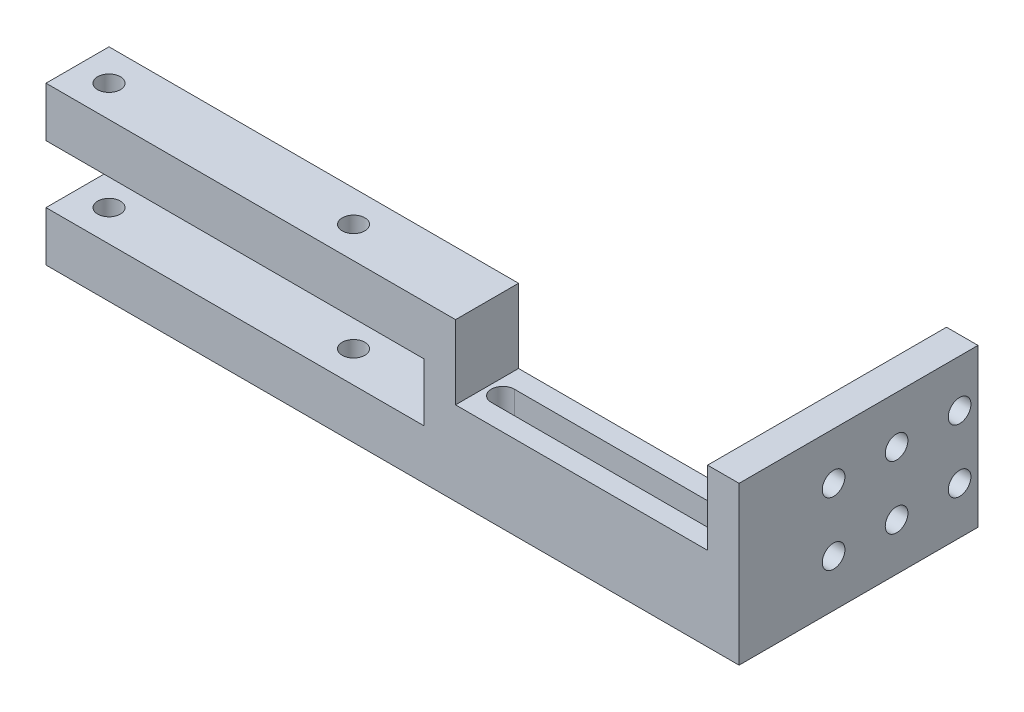
from build123d import *

# Parameters (mm, degrees)
SKETCH1_W           = 110
SKETCH1_H           = 10
SKETCH1_R           = 1.8
BOSS_EXTRUDE1_DEPTH = 25
SKETCH2_W           = 10
SKETCH2_H           = 9.2
CUT_EXTRUDE1_DEPTH  = 60
SKETCH16_W          = 5
SKETCH16_H          = 25
BOSS_EXTRUDE2_DEPTH = 10
SKETCH17_R          = 1.8
CUT_EXTRUDE6_DEPTH  = 10
SKETCH18_W          = 5
SKETCH18_H          = 25
BOSS_EXTRUDE3_DEPTH = 20
SKETCH19_R          = 1.8
CUT_EXTRUDE7_DEPTH  = 12
SKETCH20_W          = 5
SKETCH20_H          = 2.078520269
CUT_EXTRUDE8_DEPTH  = 46
SKETCH21_W          = 40
SKETCH21_H          = 10
CUT_EXTRUDE9_DEPTH  = 11.715
CUT_EXTRUDE10_DEPTH = 13.285


with BuildPart() as part:
    # Sketch1 → Boss-Extrude1 (new body)
    with BuildSketch(Plane(origin=(0, 0, 0), x_dir=(1, 0, 0), z_dir=(0, 1, 0))):
        with Locations((55, 5)):
            Rectangle(SKETCH1_W, SKETCH1_H)
        with Locations(Location((5, 5, 0), (0, 0, 270))):
            Circle(SKETCH1_R, mode=Mode.SUBTRACT)
        with Locations(Location((43.81, 5, 0), (0, 0, 270))):
            Circle(SKETCH1_R, mode=Mode.SUBTRACT)
    extrude(amount=BOSS_EXTRUDE1_DEPTH)

    # Sketch2 → Cut-Extrude1 (cut)
    with BuildSketch(Plane.ZY):
        with Locations((-5, 12.5)):
            Rectangle(SKETCH2_W, SKETCH2_H)
    extrude(amount=-CUT_EXTRUDE1_DEPTH, mode=Mode.SUBTRACT)

    # Sketch16 → Boss-Extrude2 (add)
    with BuildSketch(Plane(origin=(0, 0, -10), x_dir=(-1, 0, 0), z_dir=(0, 0, -1))):
        with Locations((-107.5, 12.5)):
            Rectangle(SKETCH16_W, SKETCH16_H)
    extrude(amount=BOSS_EXTRUDE2_DEPTH)

    # Sketch17 → Cut-Extrude6 (cut)
    with BuildSketch(Plane(origin=(110, 0, 0), x_dir=(0, 0, -1), z_dir=(1, 0, 0))):
        with Locations((15, 7.5)):
            Circle(SKETCH17_R)
        with Locations((15, 17.5)):
            Circle(SKETCH17_R)
    extrude(amount=-CUT_EXTRUDE6_DEPTH, mode=Mode.SUBTRACT)

    # Sketch18 → Boss-Extrude3 (add)
    with BuildSketch(Plane(origin=(0, 0, -20), x_dir=(-1, 0, 0), z_dir=(0, 0, -1))):
        with Locations((-107.5, 12.5)):
            Rectangle(SKETCH18_W, SKETCH18_H)
    extrude(amount=BOSS_EXTRUDE3_DEPTH)

    # Sketch19 → Cut-Extrude7 (cut)
    with BuildSketch(Plane.ZY.offset(-105)):
        with Locations((-25, 17.5)):
            Circle(SKETCH19_R)
        with Locations((-25, 7.5)):
            Circle(SKETCH19_R)
        with Locations((-35, 17.5)):
            Circle(SKETCH19_R)
        with Locations((-35, 7.5)):
            Circle(SKETCH19_R)
    extrude(amount=-CUT_EXTRUDE7_DEPTH, mode=Mode.SUBTRACT)

    # Sketch20 → Cut-Extrude8 (cut)
    with BuildSketch(Plane.XZ):
        with Locations((107.5, -38.960739866)):
            Rectangle(SKETCH20_W, SKETCH20_H)
    extrude(amount=-CUT_EXTRUDE8_DEPTH, mode=Mode.SUBTRACT)

    # Sketch21 → Cut-Extrude9 (cut)
    with BuildSketch(Plane(origin=(0, 25, 0), x_dir=(1, 0, 0), z_dir=(0, 1, 0))):
        with Locations((85, 5)):
            Rectangle(SKETCH21_W, SKETCH21_H)
    extrude(amount=-CUT_EXTRUDE9_DEPTH, mode=Mode.SUBTRACT)

    # Sketch23 → Cut-Extrude10 (cut)
    with BuildSketch(Plane(origin=(0, 13.285, 0), x_dir=(1, 0, 0), z_dir=(0, 1, 0))):
        with BuildLine():
            Line((67.5, 6.825), (102.5, 6.825))
            ThreePointArc((102.5, 6.825), (104.325, 5), (102.5, 3.175))
            Line((102.5, 3.175), (67.5, 3.175))
            ThreePointArc((67.5, 3.175), (65.675, 5), (67.5, 6.825))
        make_face()
    extrude(amount=-CUT_EXTRUDE10_DEPTH, mode=Mode.SUBTRACT)


solid = part.part
